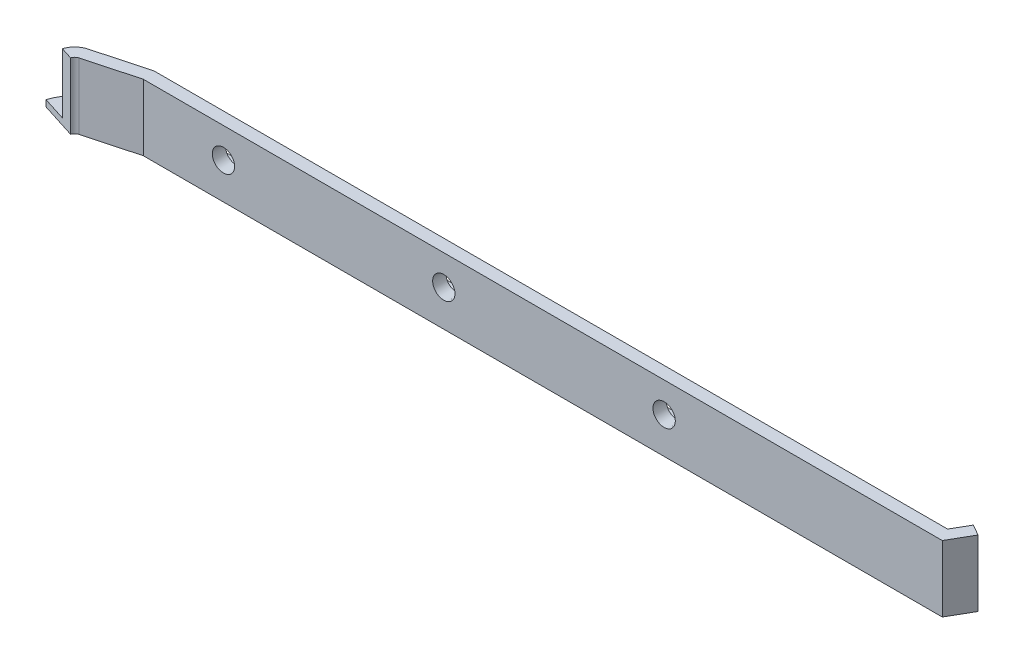
from build123d import *

# Parameters (mm, degrees)
EXTRUDE_THIN1_DEPTH          = 9.525
SKETCH3_R                    = 1.65
CUT_EXTRUDE1_DEPTH           = 75.946970354
CUT_EXTRUDE1_DRAFT           = 3.5
CUT_EXTRUDE1_PROFILE_2_DEPTH = 75.946970354
CUT_EXTRUDE1_PROFILE_2_DRAFT = 3.5
CUT_EXTRUDE1_PROFILE_3_DEPTH = 75.946970354
CUT_EXTRUDE1_PROFILE_3_DRAFT = 3.5
EXTRUDE_THIN2_START          = 1
EXTRUDE_THIN2_DEPTH          = 1


with BuildPart() as part:
    # Sketch2 → Extrude-Thin1 (new body)
    with BuildSketch(Plane.XZ.offset(4.7625)):
        with BuildLine():
            Line((63.25, -2.598076211), (61.75, 0))
            Line((61.75, 0), (-64.275, 0))
            Line((-64.275, 0), (-72.561586906, 2.235175454))
            ThreePointArc((-72.561586906, 2.235175454), (-73.854260092, 2.964003531), (-74.639461328, 4.223230813))
            Line((-74.639461328, 4.223230813), (-72.733358502, 4.828847868))
            ThreePointArc((-72.733358502, 4.828847868), (-72.471624756, 4.409105441), (-72.040733695, 4.166162748))
            Line((-72.040733695, 4.166162748), (-64.010001325, 2))
            Line((-64.010001325, 2), (62.904700538, 2))
            Line((62.904700538, 2), (64.982050808, -1.598076211))
            Line((64.982050808, -1.598076211), (63.25, -2.598076211))
        make_face()
    extrude(amount=-EXTRUDE_THIN1_DEPTH)


with BuildPart() as cut_extrude1_tool:
    # Sketch3 → Cut-Extrude1 (with draft: the straight prism first)
    with BuildSketch(Plane(origin=(0, 0, 0), x_dir=(-1, 0, 0), z_dir=(0, 0, -1))):
        with Locations((51.275, 0)):
            Circle(SKETCH3_R)
    extrude(amount=-CUT_EXTRUDE1_DEPTH)
    # Cut-Extrude1: the draft: its side faces are tilted about the plane it starts from
    cut_extrude1_sides = [cut_extrude1_tool.faces().sort_by_distance(p)[0] for p in [
        (-49.625, 0, 37.973485177),
    ]]
    draft(cut_extrude1_sides, Plane(origin=(0, 0, 0), x_dir=(-1, 0, 0), z_dir=(0, 0, -1)), CUT_EXTRUDE1_DRAFT)


with BuildPart() as part_1:
    add(part.part)

    # Cut-Extrude1: cut by cut_extrude1_tool
    add(cut_extrude1_tool.part, mode=Mode.SUBTRACT)


with BuildPart() as cut_extrude1_profile_2_tool:
    # Sketch3 → Cut-Extrude1 profile 2 (with draft: the straight prism first)
    with BuildSketch(Plane(origin=(0, 0, 0), x_dir=(-1, 0, 0), z_dir=(0, 0, -1))):
        with Locations((16.275, 0)):
            Circle(SKETCH3_R)
    extrude(amount=-CUT_EXTRUDE1_PROFILE_2_DEPTH)
    # Cut-Extrude1 profile 2: the draft: its side faces are tilted about the plane it starts from
    cut_extrude1_profile_2_sides = [cut_extrude1_profile_2_tool.faces().sort_by_distance(p)[0] for p in [
        (-14.625, 0, 37.973485177),
    ]]
    draft(cut_extrude1_profile_2_sides, Plane(origin=(0, 0, 0), x_dir=(-1, 0, 0), z_dir=(0, 0, -1)), CUT_EXTRUDE1_PROFILE_2_DRAFT)


with BuildPart() as part_2:
    add(part_1.part)

    # Cut-Extrude1 profile 2: cut by cut_extrude1_profile_2_tool
    add(cut_extrude1_profile_2_tool.part, mode=Mode.SUBTRACT)


with BuildPart() as cut_extrude1_profile_3_tool:
    # Sketch3 → Cut-Extrude1 profile 3 (with draft: the straight prism first)
    with BuildSketch(Plane(origin=(0, 0, 0), x_dir=(-1, 0, 0), z_dir=(0, 0, -1))):
        with Locations((-18.725, 0)):
            Circle(SKETCH3_R)
    extrude(amount=-CUT_EXTRUDE1_PROFILE_3_DEPTH)
    # Cut-Extrude1 profile 3: the draft: its side faces are tilted about the plane it starts from
    cut_extrude1_profile_3_sides = [cut_extrude1_profile_3_tool.faces().sort_by_distance(p)[0] for p in [
        (20.375, 0, 37.973485177),
    ]]
    draft(cut_extrude1_profile_3_sides, Plane(origin=(0, 0, 0), x_dir=(-1, 0, 0), z_dir=(0, 0, -1)), CUT_EXTRUDE1_PROFILE_3_DRAFT)


with BuildPart() as part_3:
    add(part_2.part)

    # Cut-Extrude1 profile 3: cut by cut_extrude1_profile_3_tool
    add(cut_extrude1_profile_3_tool.part, mode=Mode.SUBTRACT)

    # Sketch2<2> → Extrude-Thin2 (add)
    with BuildSketch(Plane.XZ.offset(4.7625).offset(EXTRUDE_THIN2_START)):
        with BuildLine():
            Line((64.982050808, -1.598076211), (62.904700538, 2))
            Line((62.904700538, 2), (-64.010001325, 2))
            Line((-64.010001325, 2), (-72.040733695, 4.166162748))
            ThreePointArc((-72.040733695, 4.166162748), (-72.471624756, 4.409105441), (-72.733358502, 4.828847868))
            Line((-72.733358502, 4.828847868), (-78.451666979, 3.011996703))
            ThreePointArc((-78.451666979, 3.011996703), (-76.619530762, 0.073799711), (-73.603293329, -1.626799136))
            Line((-73.603293329, -1.626799136), (-64.804997349, -4))
            Line((-64.804997349, -4), (59.440598923, -4))
            Line((59.440598923, -4), (59.785898385, -4.598076211))
            Line((59.785898385, -4.598076211), (64.982050808, -1.598076211))
        make_face()
    extrude(amount=-EXTRUDE_THIN2_DEPTH)


solid = part_3.part
